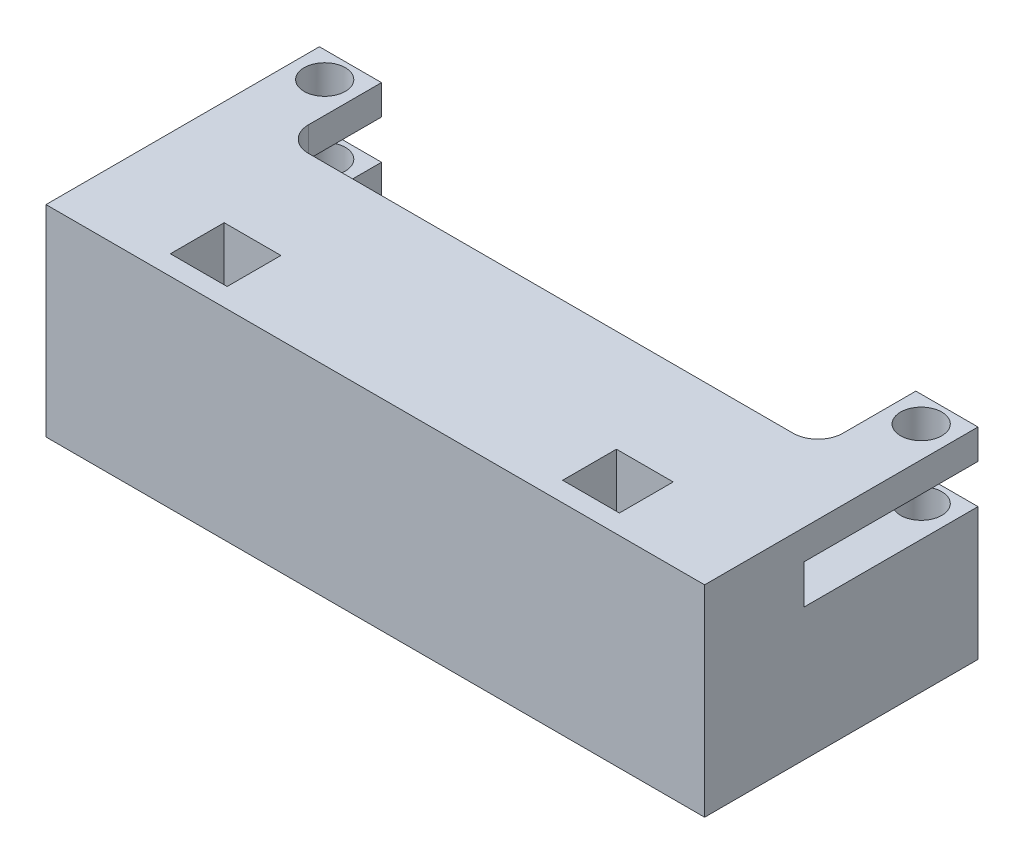
from build123d import *

# Parameters (mm, degrees)
BOSS_EXTRUDE1_DEPTH     = 20.574
CUT_EXTRUDE1_DEPTH      = 3.81
CUT_EXTRUDE1_DEPTH_BACK = 14.224
SKETCH3_W               = 67.31
SKETCH3_H               = 4
SKETCH4_R               = 2.105577283
CUT_EXTRUDE2_DEPTH      = 42.846259104
SKETCH6_W               = 5.8
SKETCH6_H               = 5.5
CUT_EXTRUDE3_DEPTH      = 42.846259104


with BuildPart() as part:
    # Sketch2 → Boss-Extrude1 (new body)
    with BuildSketch(Plane(origin=(0, 0, 0), x_dir=(1, 0, 0), z_dir=(0, 1, 0))):
        with BuildLine():
            Line((-33.655, 13.97), (-27.305, 13.97))
            Line((-27.305, 13.97), (-27.305, 6.51))
            ThreePointArc((-27.305, 6.51), (-26.561051224, 4.713948776), (-24.765, 3.97))
            Line((-24.765, 3.97), (24.765, 3.97))
            ThreePointArc((24.765, 3.97), (26.561051224, 4.713948776), (27.305, 6.51))
            Line((27.305, 6.51), (27.305, 13.97))
            Line((27.305, 13.97), (33.655, 13.97))
            Line((33.655, 13.97), (33.655, -13.97))
            Line((33.655, -13.97), (-33.655, -13.97))
            Line((-33.655, -13.97), (-33.655, 13.97))
        make_face()
    extrude(amount=BOSS_EXTRUDE1_DEPTH)

    # Sketch3 → Cut-Extrude1 (cut, two sides: drawn at the far end of the back side and taken through both)
    with BuildSketch(Plane.XY.offset(-CUT_EXTRUDE1_DEPTH_BACK)):
        with Locations((0, 15.526)):
            Rectangle(SKETCH3_W, SKETCH3_H)
    extrude(amount=CUT_EXTRUDE1_DEPTH + CUT_EXTRUDE1_DEPTH_BACK, mode=Mode.SUBTRACT)

    # Sketch4 → Cut-Extrude2 (cut, through all)
    with BuildSketch(Plane(origin=(0, 20.574, 0), x_dir=(1, 0, 0), z_dir=(0, 1, 0))):
        with Locations(Location((-30.48, 11.337723829, 0), (0, 0, 270))):
            Circle(SKETCH4_R)
        with Locations(Location((30.48, 11.337723829, 0), (0, 0, 90))):
            Circle(SKETCH4_R)
    extrude(amount=-CUT_EXTRUDE2_DEPTH, mode=Mode.SUBTRACT)

    # Sketch6 → Cut-Extrude3 (cut, through all)
    with BuildSketch(Plane(origin=(0, 20.574, 0), x_dir=(1, 0, 0), z_dir=(0, 1, 0))):
        with Locations((20.045, -9.22)):
            Rectangle(SKETCH6_W, SKETCH6_H)
        with Locations((-20.045, -9.22)):
            Rectangle(SKETCH6_W, SKETCH6_H)
    extrude(amount=-CUT_EXTRUDE3_DEPTH, mode=Mode.SUBTRACT)


solid = part.part
